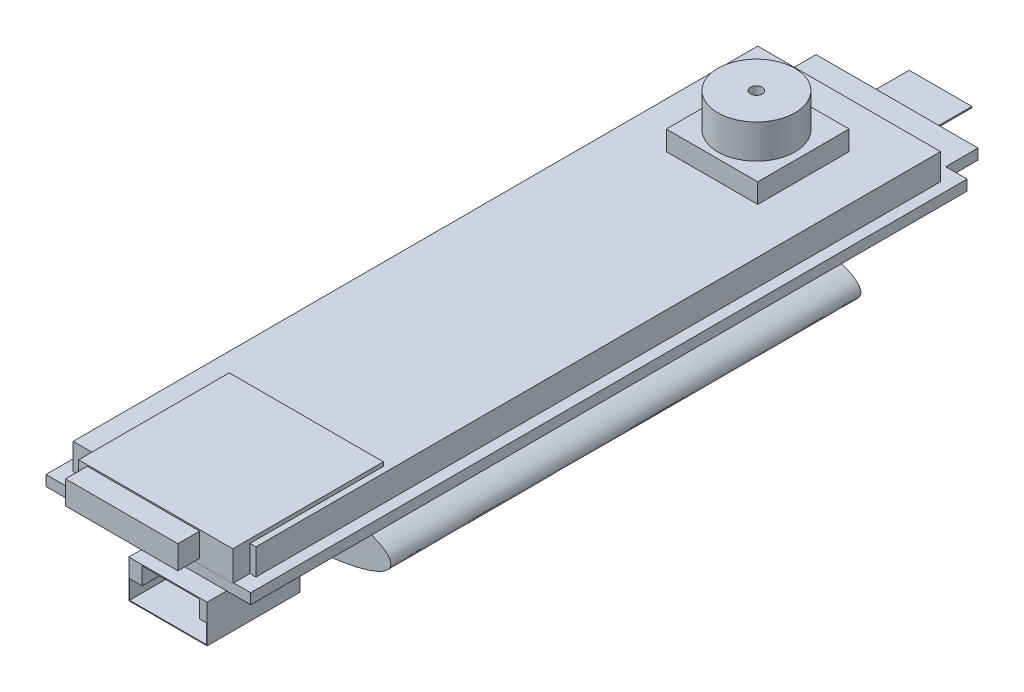
from build123d import *

# Parameters (mm, degrees)
BOSS_EXTRUDE2_DEPTH      = 6.35
BOSS_EXTRUDE2_DEPTH_BACK = 6.35
BOSS_EXTRUDE2_START      = 15.24
SKETCH4_W                = 12.7
SKETCH4_H                = 1.397
BOSS_EXTRUDE3_DEPTH      = 22.86
BOSS_EXTRUDE3_DEPTH_BACK = 22.86
SKETCH5_RX               = 10.033
SKETCH5_RY               = 2.589631332
BOSS_EXTRUDE4_DEPTH      = 36.4109
BOSS_EXTRUDE4_DEPTH_BACK = 36.4109
SKETCH6_W                = 19.9136
SKETCH6_H                = 1.016
SKETCH7_W                = 14.992697908
SKETCH7_H                = 14.648957972
BOSS_EXTRUDE6_DEPTH      = 2.921
SKETCH10_W               = 10.922
SKETCH10_H               = 2.286
BOSS_EXTRUDE7_DEPTH      = 2.115042028
CUT_EXTRUDE1_REACH       = 42.496
SKETCH11_W               = 2.0828
SKETCH11_H               = 3.1369
SKETCH12_W               = 7.62
SKETCH12_H               = 9.017
BOSS_EXTRUDE8_DEPTH      = 3.683
SKETCH13_W               = 8.89
SKETCH13_H               = 8.89
BOSS_EXTRUDE9_DEPTH      = 4.445
SKETCH14_R               = 3.748513876
BOSS_EXTRUDE10_DEPTH     = 3.302
SKETCH15_R               = 0.573513876
CUT_EXTRUDE2_DEPTH       = 3.302
SKETCH16_W               = 14.224
SKETCH16_H               = 5.9309
SKETCH16_W_2             = 6.096
SKETCH16_H_2             = 4.2291
BOSS_EXTRUDE11_DEPTH     = 0.127
CUT_EXTRUDE3_DEPTH       = 6.35
SKETCH18_W               = 8.89
SKETCH18_H               = 8.89
BOSS_EXTRUDE13_DEPTH     = 2.54


with BuildPart() as part:
    # Sketch4 → Boss-Extrude2 (new, two sides: drawn at the far end of the back side and taken through both)
    with BuildSketch(Plane.XY.offset(BOSS_EXTRUDE2_START - BOSS_EXTRUDE2_DEPTH_BACK)):
        with Locations((0, -1.2065)):
            Rectangle(SKETCH4_W, SKETCH4_H)
    extrude(amount=BOSS_EXTRUDE2_DEPTH + BOSS_EXTRUDE2_DEPTH_BACK)

    # Sketch5 → Boss-Extrude3 (add, two sides: drawn at the far end of the back side and taken through both)
    with BuildSketch(Plane.XY.offset(-BOSS_EXTRUDE3_DEPTH_BACK)):
        with Locations((0, -3.81)):
            Ellipse(SKETCH5_RX, SKETCH5_RY)
    extrude(amount=BOSS_EXTRUDE3_DEPTH + BOSS_EXTRUDE3_DEPTH_BACK)

    # Sketch6 → Boss-Extrude4 (add, two sides: drawn at the far end of the back side and taken through both)
    with BuildSketch(Plane.XY.offset(-BOSS_EXTRUDE4_DEPTH_BACK)):
        Rectangle(SKETCH6_W, SKETCH6_H)
    extrude(amount=BOSS_EXTRUDE4_DEPTH + BOSS_EXTRUDE4_DEPTH_BACK)

    # Sketch7 → Boss-Extrude6 (add)
    with BuildSketch(Plane(origin=(0, 0.508, 0), x_dir=(1, 0, 0), z_dir=(0, 1, 0))):
        with Locations((0.809451046, -29.181178986)):
            Rectangle(SKETCH7_W, SKETCH7_H)
    extrude(amount=BOSS_EXTRUDE6_DEPTH)

    # Sketch10 → Boss-Extrude7 (add)
    with BuildSketch(Plane.XY.offset(36.505657972)):
        with Locations((-0.381, 2.159)):
            Rectangle(SKETCH10_W, SKETCH10_H)
    extrude(amount=BOSS_EXTRUDE7_DEPTH)

    # Sketch11 → Cut-Extrude1 (cut, up to next)
    with BuildSketch(Plane(origin=(0, 0.508, 0), x_dir=(1, 0, 0), z_dir=(0, 1, 0)), mode=Mode.PRIVATE) as cut_extrude1_sk1:
        with Locations((-8.9154, 34.84245)):
            Rectangle(SKETCH11_W, SKETCH11_H)
    cut_extrude1_tool1 = extrude(cut_extrude1_sk1.sketch, amount=-CUT_EXTRUDE1_REACH, mode=Mode.PRIVATE) & part.part
    # Sketch11 → Cut-Extrude1 (cut, up to next)
    with BuildSketch(Plane(origin=(0, 0.508, 0), x_dir=(1, 0, 0), z_dir=(0, 1, 0)), mode=Mode.PRIVATE) as cut_extrude1_sk2:
        with Locations((8.9154, 34.84245)):
            Rectangle(SKETCH11_W, SKETCH11_H)
    cut_extrude1_tool2 = extrude(cut_extrude1_sk2.sketch, amount=-CUT_EXTRUDE1_REACH, mode=Mode.PRIVATE) & part.part
    add(cut_extrude1_tool1.solids().sort_by_distance((-8.9154, 0.508, -34.84245))[0], mode=Mode.SUBTRACT)
    add(cut_extrude1_tool2.solids().sort_by_distance((8.9154, 0.508, -34.84245))[0], mode=Mode.SUBTRACT)

    # Sketch12 → Boss-Extrude8 (add)
    with BuildSketch(Plane.XZ.offset(0.508)):
        with Locations((3.81, 33.8074)):
            Rectangle(SKETCH12_W, SKETCH12_H)
    extrude(amount=BOSS_EXTRUDE8_DEPTH)

    # Sketch13 → Boss-Extrude9 (add)
    with BuildSketch(Plane(origin=(0, 0.508, 0), x_dir=(1, 0, 0), z_dir=(0, 1, 0))):
        with Locations((0, 22.86)):
            Rectangle(SKETCH13_W, SKETCH13_H)
    extrude(amount=BOSS_EXTRUDE9_DEPTH)

    # Sketch14 → Boss-Extrude10 (add)
    with BuildSketch(Plane(origin=(0, 4.953, 0), x_dir=(1, 0, 0), z_dir=(0, 1, 0))):
        with Locations(Location((0, 22.733, 0), (0, 0, 90))):
            Circle(SKETCH14_R)
    extrude(amount=BOSS_EXTRUDE10_DEPTH)

    # Sketch15 → Cut-Extrude2 (cut)
    with BuildSketch(Plane(origin=(0, 8.255, 0), x_dir=(1, 0, 0), z_dir=(0, 1, 0))):
        with Locations(Location((0, 22.733, 0), (0, 0, 270))):
            Circle(SKETCH15_R)
    extrude(amount=-CUT_EXTRUDE2_DEPTH, mode=Mode.SUBTRACT)

    # Sketch16 → Boss-Extrude11 (add)
    with BuildSketch(Plane.XZ.offset(0.508)):
        with Locations((0, -33.44545)):
            Rectangle(SKETCH16_W, SKETCH16_H)
        with Locations((0, -38.52545)):
            Rectangle(SKETCH16_W_2, SKETCH16_H_2)
    extrude(amount=BOSS_EXTRUDE11_DEPTH)

    # Sketch17 → Cut-Extrude3 (cut)
    with BuildSketch(Plane.XY.offset(38.3159)):
        Polygon((1.305274753, -0.6096), (6.889189319, -0.6096), (6.889189319, -2.287768833), (7.5438, -2.287768833), (7.5438, -4.1148), (0.0762, -4.1148), (0.0762, -2.287768833), (1.305274753, -2.287768833), align=None)
    extrude(amount=-CUT_EXTRUDE3_DEPTH, mode=Mode.SUBTRACT)

    # Sketch18 → Boss-Extrude13 (add)
    with BuildSketch(Plane(origin=(0, 0.508, 0), x_dir=(1, 0, 0), z_dir=(0, 1, 0))):
        Polygon((8.3058, -34.838229956), (8.89, -34.838229956), (8.89, 31.75), (-8.89, 31.75), (-8.89, -34.838229956), (-6.686897908, -34.838229956), (-6.686897908, -21.8567), (8.3058, -21.8567), align=None)
        with Locations((0, 22.86)):
            Rectangle(SKETCH18_W, SKETCH18_H, mode=Mode.SUBTRACT)
    extrude(amount=BOSS_EXTRUDE13_DEPTH)


solid = part.part
